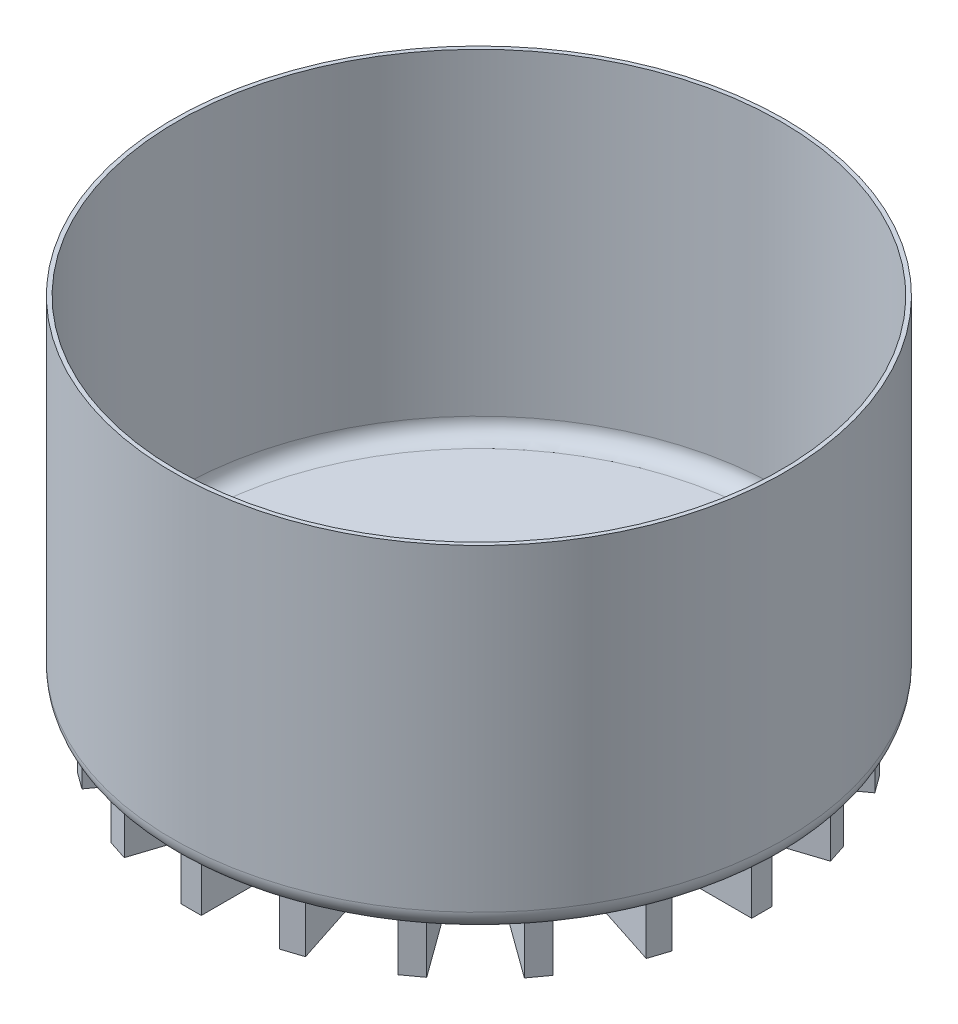
from build123d import *

# Parameters (mm, degrees)
SKETCH1_R           = 189.992
BOSS_EXTRUDE1_DEPTH = 210.058
FILLET1_R           = 12.7
SHELL1_T            = -2.5
SKETCH2_W           = 88.646
SKETCH2_H           = 12.7
BOSS_EXTRUDE2_DEPTH = 32.258
CIRPATTERN1_COUNT   = 20


with BuildPart() as part:
    # Sketch1 → Boss-Extrude1 (new body)
    with BuildSketch(Plane(origin=(0, 0, 0), x_dir=(1, 0, 0), z_dir=(0, 1, 0))):
        Circle(SKETCH1_R)
    extrude(amount=BOSS_EXTRUDE1_DEPTH)

    # Fillet1
    fillet1_edges = [part.edges().sort_by_distance(p)[0] for p in [
        (-189.992, 0, 0),
    ]]
    fillet(fillet1_edges, radius=FILLET1_R)

    # Shell1
    shell1_openings = [part.faces().sort_by_distance(p)[0] for p in [
        (0, 210.058, 0),
    ]]
    offset(amount=SHELL1_T, openings=shell1_openings, kind=Kind.INTERSECTION)

    # Sketch2 → Boss-Extrude2 (add)
    with BuildSketch(Plane(origin=(0, 0, 0), x_dir=(-1, 0, 0), z_dir=(0, -1, 0))):
        with Locations((132.969, 1.507022024)):
            Rectangle(SKETCH2_W, SKETCH2_H)
    boss_extrude2 = extrude(amount=BOSS_EXTRUDE2_DEPTH)

    # CirPattern1: Boss-Extrude2 ×20 about axis
    cirpattern1_axis = Axis((0, 210.058, 0), (0, -1, 0))
    for i in range(1, CIRPATTERN1_COUNT):
        add(boss_extrude2.rotate(cirpattern1_axis, i * 360 / CIRPATTERN1_COUNT))


solid = part.part
